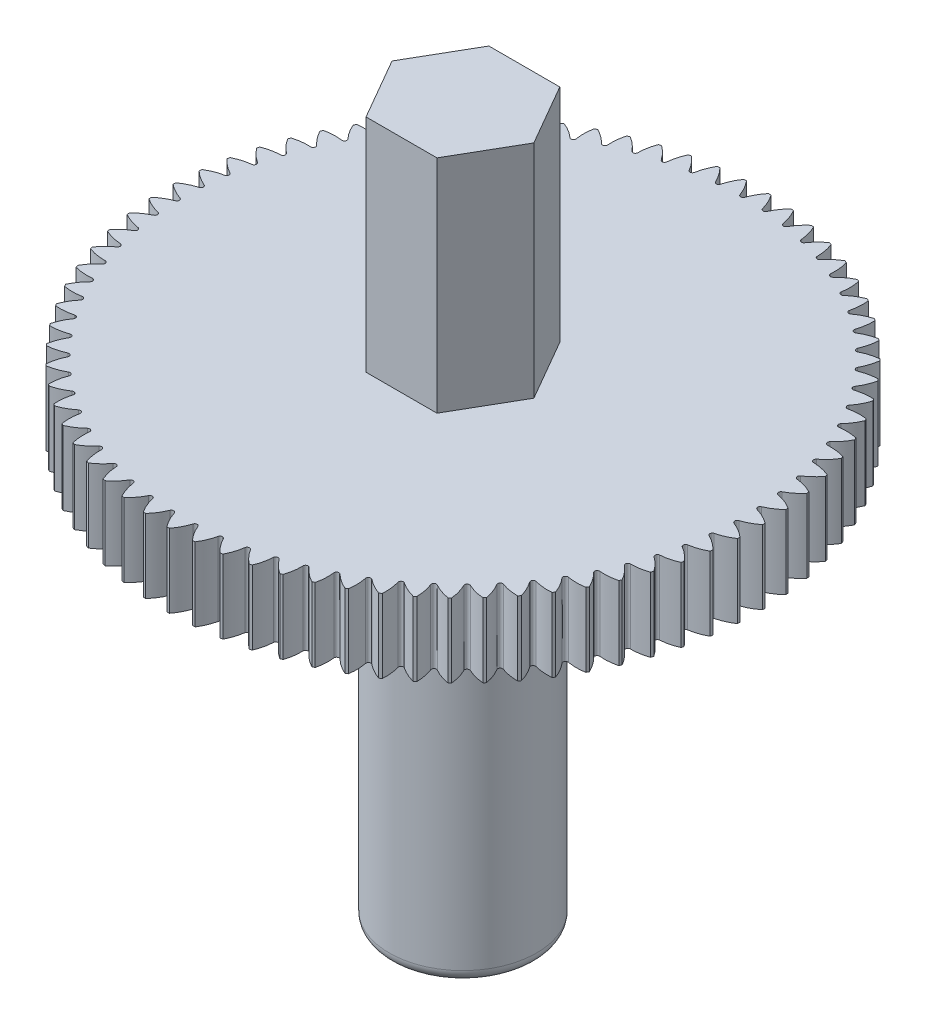
from build123d import *

# Parameters (mm, degrees)
FILLET1_R          = 0.5
CUT_EXTRUDE1_START = -9
SKETCH3_R          = 3
CUT_EXTRUDE1_DEPTH = 9
CUT_EXTRUDE2_REACH = 28.23
CIRPATTERN1_COUNT  = 75


with BuildPart() as part:
    # Sketch2 → Revolve1 (revolve)
    with BuildSketch(Plane.XY, mode=Mode.PRIVATE) as revolve1_sk:
        Polygon((0, 0), (0, 29), (3, 29), (3, 20), (12, 20), (12, 17), (3, 17), (3, 0), align=None)
    revolve(revolve1_sk.sketch.rotate(Axis((0, 0, 0), (0, 1, 0)), 90), axis=Axis((0, 0, 0), (0, 1, 0)))

    # Fillet1
    fillet1_edges = [part.edges().sort_by_distance(p)[0] for p in [
        (0, 0, 3),
    ]]
    fillet(fillet1_edges, radius=FILLET1_R)

    # Sketch3 → Cut-Extrude1 (cut)
    with BuildSketch(Plane(origin=(0, 29, 0), x_dir=(1, 0, 0), z_dir=(0, 1, 0)).offset(CUT_EXTRUDE1_START)):
        with Locations(Location((0, 0, 0), (0, 0, 90))):
            Circle(SKETCH3_R)
        Polygon((1.443375673, 2.5), (-1.443375673, 2.5), (-2.886751346, 0), (-1.443375673, -2.5), (1.443375673, -2.5), (2.886751346, 0), align=None, mode=Mode.SUBTRACT)
    extrude(amount=CUT_EXTRUDE1_DEPTH, mode=Mode.SUBTRACT)

    # Sketch4 → Cut-Extrude2 (cut, up to next)
    with BuildSketch(Plane(origin=(0, 20, 0), x_dir=(1, 0, 0), z_dir=(0, 1, 0)), mode=Mode.PRIVATE) as cut_extrude2_sk1:
        with BuildLine():
            ThreePointArc((-0.45, 11.991559532), (-0.244185037, 11.69752696), (-0.094236566, 11.371443523))
            ThreePointArc((-0.094236566, 11.371443523), (0, 11.304902), (0.094236566, 11.371443523))
            ThreePointArc((0.094236566, 11.371443523), (0.244185037, 11.69752696), (0.45, 11.991559532))
            ThreePointArc((0.45, 11.991559532), (0, 12), (-0.45, 11.991559532))
        make_face()
    cut_extrude2_tool1 = extrude(cut_extrude2_sk1.sketch, amount=-CUT_EXTRUDE2_REACH, mode=Mode.PRIVATE) & part.part
    cut_extrude2 = cut_extrude2_tool1.solids().sort_by_distance((0, 20, -11.747257))[0]
    add(cut_extrude2, mode=Mode.SUBTRACT)

    # CirPattern1: Cut-Extrude2 ×75 about axis
    cirpattern1_axis = Axis((0, 0, 0), (0, 1, 0))
    for i in range(1, CIRPATTERN1_COUNT):
        add(cut_extrude2.rotate(cirpattern1_axis, i * 360 / CIRPATTERN1_COUNT), mode=Mode.SUBTRACT)


solid = part.part
